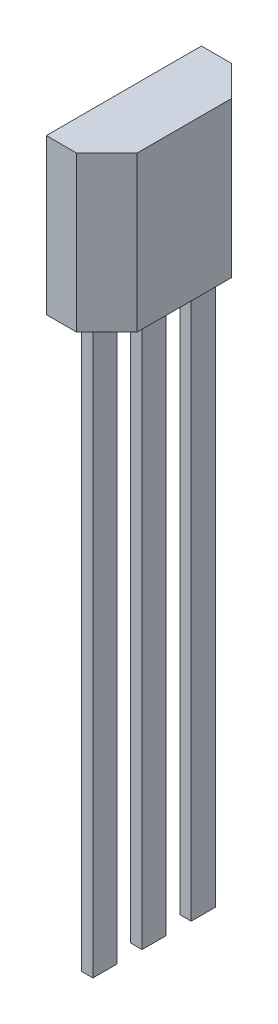
from build123d import *

# Parameters (mm, degrees)
BOSS_EXTRUDE3_DEPTH      = 2.4
BOSS_EXTRUDE3_DEPTH_BACK = 1.7
SKETCH5_W                = 0.3
SKETCH5_H                = 0.64
BOSS_EXTRUDE4_DEPTH      = 15


with BuildPart() as part:
    # Sketch4 → Boss-Extrude3 (new, two sides: drawn at the far end of the back side and taken through both)
    with BuildSketch(Plane(origin=(0, 0, 0), x_dir=(1, 0, 0), z_dir=(0, 1, 0)).offset(-BOSS_EXTRUDE3_DEPTH_BACK)):
        Polygon((0.8, 2.05), (1.6, 1.25), (1.6, -1.25), (0.8, -2.05), (0, -2.05), (0, 2.05), align=None)
    extrude(amount=BOSS_EXTRUDE3_DEPTH + BOSS_EXTRUDE3_DEPTH_BACK)

    # Sketch5 → Boss-Extrude4 (add)
    with BuildSketch(Plane.XZ.offset(1.7)):
        with Locations((0.65, 1.3)):
            Rectangle(SKETCH5_W, SKETCH5_H)
        with Locations((0.65, 0)):
            Rectangle(SKETCH5_W, SKETCH5_H)
        with Locations((0.65, -1.3)):
            Rectangle(SKETCH5_W, SKETCH5_H)
    extrude(amount=BOSS_EXTRUDE4_DEPTH)


solid = part.part
